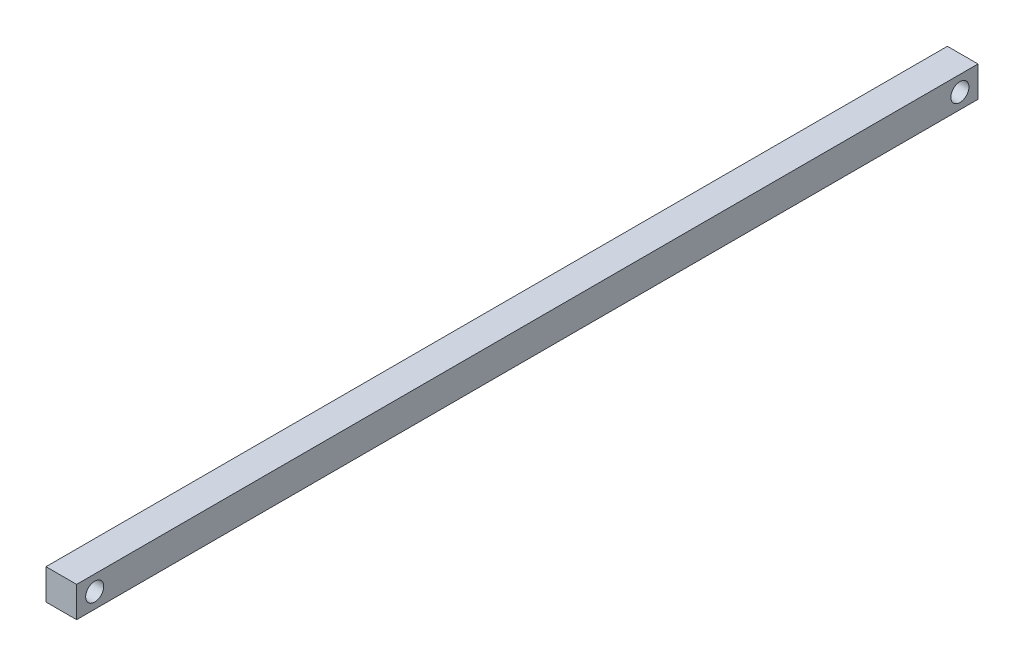
from build123d import *

# Parameters (mm, degrees)
SKETCH1_W           = 373.8
SKETCH1_H           = 12.7
SKETCH1_R           = 3.75
BOSS_EXTRUDE1_DEPTH = 12.7


with BuildPart() as part:
    # Sketch1 → Boss-Extrude1 (new body)
    with BuildSketch(Plane(origin=(0, 0, 0), x_dir=(0, 0, -1), z_dir=(1, 0, 0))):
        with Locations((186.9, 6.35)):
            Rectangle(SKETCH1_W, SKETCH1_H)
        with Locations((7.5, 6.35)):
            Circle(SKETCH1_R, mode=Mode.SUBTRACT)
        with Locations((366.3, 6.35)):
            Circle(SKETCH1_R, mode=Mode.SUBTRACT)
    extrude(amount=BOSS_EXTRUDE1_DEPTH)


solid = part.part
